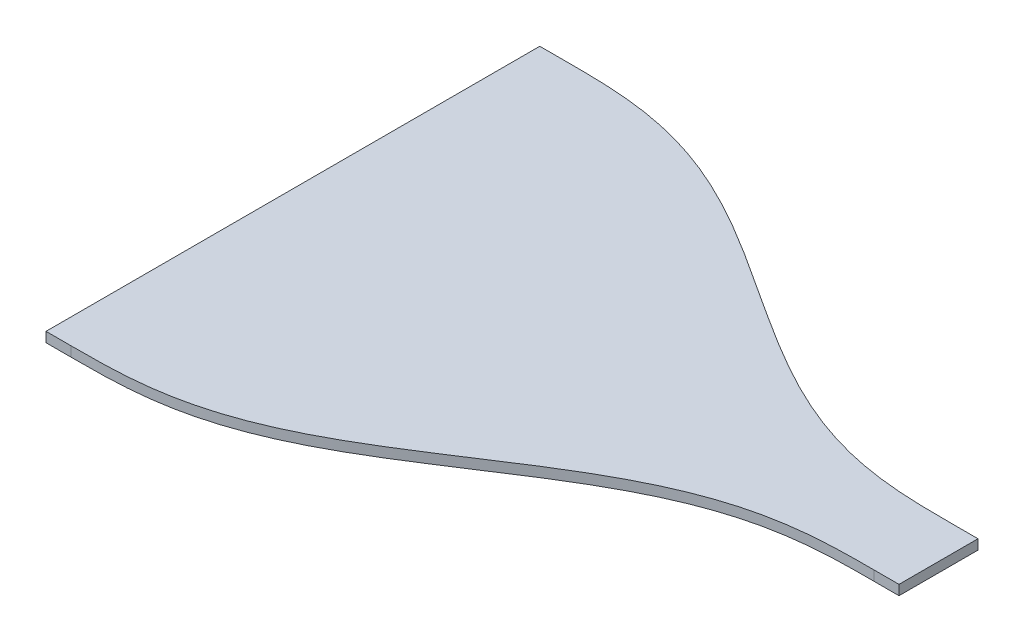
from build123d import *

# Parameters (mm, degrees)
BOSS_EXTRUDE1_DEPTH = 10


with BuildPart() as part:
    # Sketch2 → Boss-Extrude1 (new body)
    with BuildSketch(Plane(origin=(0, 0, 0), x_dir=(1, 0, 0), z_dir=(0, 1, 0))):
        with BuildLine():
            Line((602.960000001, -40), (628.360000001, -40))
            Line((628.360000001, -40), (628.360000001, 40))
            Line((628.360000001, 40), (602.960000001, 40))
            add(Edge.make_bspline(
                [(0, 250), (1.131031236, 250), (3.358770292, 250.000000003), (8.796297806, 249.997784221), (12.313824052, 249.983976491), (16.948827051, 249.959167009), (20.677742413, 249.92117332), (24.867135006, 249.868183184), (29.453823448, 249.780646369), (34.872840698, 249.638764529), (40.33505504, 249.444262899), (45.967271128, 249.187011571), (53.177523523, 248.77155286), (61.98878186, 248.108986796), (72.240608905, 247.08571443), (83.917829127, 245.539765846), (95.533244533, 243.595057869), (107.073902326, 241.240157871), (118.522065352, 238.473331116), (132.700805727, 234.508961084), (146.684800287, 229.893458887), (160.454632321, 224.677267983), (174.044662558, 218.910987655), (184.831827692, 213.982198347), (195.491796688, 208.784697651), (206.031078869, 203.347077443), (216.421911741, 197.717889727), (226.674958166, 191.925628535), (239.377568262, 184.487962432), (254.460973864, 175.294585429), (271.876468287, 164.276962988), (291.628985453, 151.451312882), (311.331014557, 138.548686677), (331.083531617, 125.723038473), (350.986954957, 113.131465206), (371.139716909, 100.940384071), (389.10946348, 90.761663453), (404.821831782, 82.50560077), (418.128182226, 76.017787755), (428.915328943, 71.089037301), (439.795009545, 66.472707342), (450.767282366, 62.19306212), (461.868765882, 58.260289969), (473.095033587, 54.698205156), (484.437746208, 51.526641761), (495.886441901, 48.75985944), (505.983655162, 46.699297059), (514.687032, 45.189499616), (521.964646592, 44.098671482), (527.803696286, 43.324303169), (533.648357788, 42.645452029), (539.514027562, 42.058648284), (545.369191286, 41.559731198), (551.261066711, 41.143844609), (558.313030396, 40.735935788), (565.335468194, 40.442966308), (572.056741451, 40.244363645), (578.932534832, 40.119311859), (583.985524287, 40.054535351), (589.91945744, 40.017995984), (594.28348806, 40.002215768), (599.589193263, 40.000000038), (601.828968765, 40), (602.960000001, 40)],
                knots=[0.078174199, 0.078174199, 0.078174199, 0.078174199, 0.078174199, 0.085116359, 0.092058519, 0.099000679, 0.102471759, 0.105942839, 0.112885, 0.11982716, 0.12676932, 0.13371148, 0.141333544, 0.148955608, 0.164199735, 0.179443845, 0.194687956, 0.20993208, 0.225176204, 0.240420329, 0.255664454, 0.286152645, 0.301396827, 0.316641009, 0.332099848, 0.347558687, 0.36280282, 0.378046954, 0.393291087, 0.40853522, 0.439023475, 0.469511731, 0.5, 0.530488269, 0.560976525, 0.59146478, 0.621953046, 0.652441313, 0.667900152, 0.683358991, 0.698603173, 0.713847355, 0.72909145, 0.744335546, 0.759579671, 0.774823796, 0.79006792, 0.805312044, 0.812934099, 0.820556155, 0.82817821, 0.835800265, 0.843422329, 0.851044392, 0.858666456, 0.86628852, 0.88017284, 0.887115, 0.894057161, 0.900999321, 0.907941481, 0.914883641, 0.921825801, 0.921825801, 0.921825801, 0.921825801, 0.921825801], degree=4))
            Line((0, 250), (-25.4, 250))
            Line((-25.4, 250), (-25.4, -250))
            Line((-25.4, -250), (0, -250))
            add(Edge.make_bspline(
                [(0, -250), (1.131031236, -250), (3.358770292, -250.000000003), (8.796297806, -249.997784221), (12.313824052, -249.983976491), (16.948827051, -249.959167009), (20.677742413, -249.92117332), (24.867135006, -249.868183184), (29.453823448, -249.780646369), (34.872840698, -249.638764529), (40.33505504, -249.444262899), (45.967271128, -249.187011571), (53.177523523, -248.77155286), (61.98878186, -248.108986796), (72.240608905, -247.08571443), (83.917829127, -245.539765846), (95.533244533, -243.595057869), (107.073902326, -241.240157871), (118.522065351, -238.473331116), (132.700805727, -234.508961084), (146.684800287, -229.893458887), (160.454632321, -224.677267983), (174.044662558, -218.910987655), (184.831827692, -213.982198347), (195.491796688, -208.784697651), (206.031078869, -203.347077443), (216.421911741, -197.717889727), (226.674958166, -191.925628535), (239.377568262, -184.487962432), (254.460973864, -175.294585429), (271.876468287, -164.276962988), (291.628985453, -151.451312882), (311.331014556, -138.548686677), (331.083531617, -125.723038473), (350.986954957, -113.131465206), (371.139716909, -100.940384071), (389.10946348, -90.761663453), (404.821831782, -82.505600769), (418.128182226, -76.017787755), (428.915328943, -71.089037301), (439.795009544, -66.472707341), (450.767282366, -62.19306212), (461.868765882, -58.260289969), (473.095033586, -54.698205156), (484.437746208, -51.526641761), (495.886441901, -48.75985944), (505.983655162, -46.699297059), (514.687032, -45.189499616), (521.964646592, -44.098671482), (527.803696286, -43.324303169), (533.648357788, -42.645452029), (539.514027562, -42.058648284), (545.369191286, -41.559731198), (551.261066711, -41.143844609), (558.313030396, -40.735935788), (565.335468194, -40.442966308), (572.056741451, -40.244363645), (578.932534832, -40.119311858), (583.985524287, -40.054535351), (589.91945744, -40.017995984), (594.28348806, -40.002215768), (599.589193263, -40.000000038), (601.828968765, -40), (602.960000001, -40)],
                knots=[0.078174199, 0.078174199, 0.078174199, 0.078174199, 0.078174199, 0.085116359, 0.092058519, 0.099000679, 0.102471759, 0.105942839, 0.112885, 0.11982716, 0.12676932, 0.13371148, 0.141333544, 0.148955608, 0.164199735, 0.179443845, 0.194687956, 0.20993208, 0.225176204, 0.240420329, 0.255664454, 0.286152645, 0.301396827, 0.316641009, 0.332099848, 0.347558687, 0.36280282, 0.378046954, 0.393291087, 0.40853522, 0.439023475, 0.469511731, 0.5, 0.530488269, 0.560976525, 0.59146478, 0.621953046, 0.652441313, 0.667900152, 0.683358991, 0.698603173, 0.713847355, 0.72909145, 0.744335546, 0.759579671, 0.774823796, 0.79006792, 0.805312044, 0.812934099, 0.820556155, 0.82817821, 0.835800265, 0.843422329, 0.851044392, 0.858666456, 0.86628852, 0.88017284, 0.887115, 0.894057161, 0.900999321, 0.907941481, 0.914883641, 0.921825801, 0.921825801, 0.921825801, 0.921825801, 0.921825801], degree=4))
        make_face()
    extrude(amount=BOSS_EXTRUDE1_DEPTH)


solid = part.part
